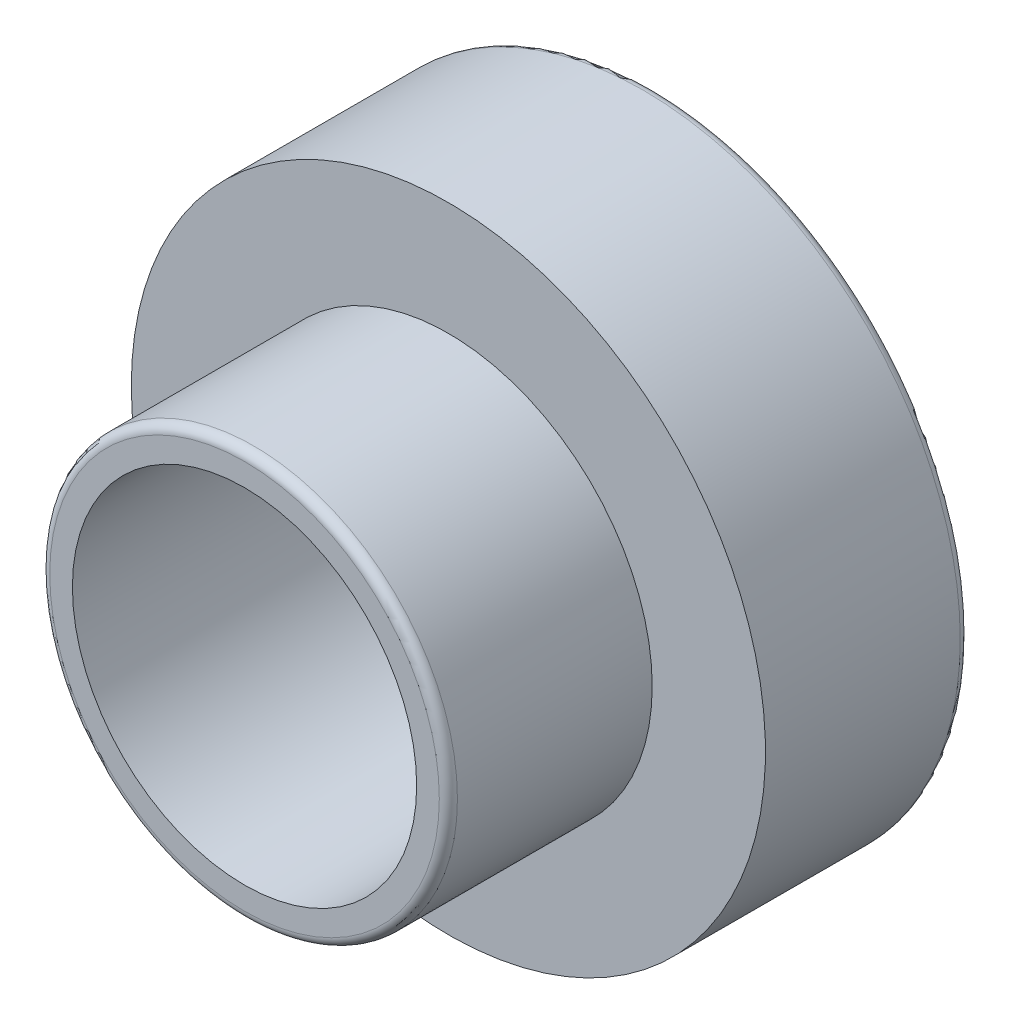
from build123d import *

# Parameters (mm, degrees)
SKETCH_1_R          = 70
EXTRUDE_1_DEPTH     = 90
SKETCH_2_R          = 38
CUT_EXTRUDE_1_DEPTH = 134.790881603
CUT_EXTRUDE_START   = -45
SKETCH_3_R          = 70
SKETCH_3_R_2        = 45
CUT_EXTRUDE_2_DEPTH = 45
FILLET_1_R          = 2


with BuildPart() as part:
    # 草图1 → 凸台-拉伸1 (new body)
    with BuildSketch(Plane.XY):
        with Locations(Location((0, 0, 0), (0, 0, 180))):
            Circle(SKETCH_1_R)
    extrude(amount=EXTRUDE_1_DEPTH)

    # 草图2 → 切除-拉伸1 (cut, through all)
    with BuildSketch(Plane.XY.offset(90)):
        Circle(SKETCH_2_R)
    extrude(amount=-CUT_EXTRUDE_1_DEPTH, mode=Mode.SUBTRACT)

    # 草图3 → 切除-拉伸2 (cut)
    with BuildSketch(Plane.XY.offset(90).offset(CUT_EXTRUDE_START)):
        with Locations(Location((0, 0, 0), (0, 0, 180))):
            Circle(SKETCH_3_R)
        Circle(SKETCH_3_R_2, mode=Mode.SUBTRACT)
    extrude(amount=CUT_EXTRUDE_2_DEPTH, mode=Mode.SUBTRACT)

    # 圆角1
    fillet_1_edges = [part.edges().sort_by_distance(p)[0] for p in [
        (-45, 0, 90),
        (70, 0, 0),
    ]]
    fillet(fillet_1_edges, radius=FILLET_1_R)


solid = part.part
